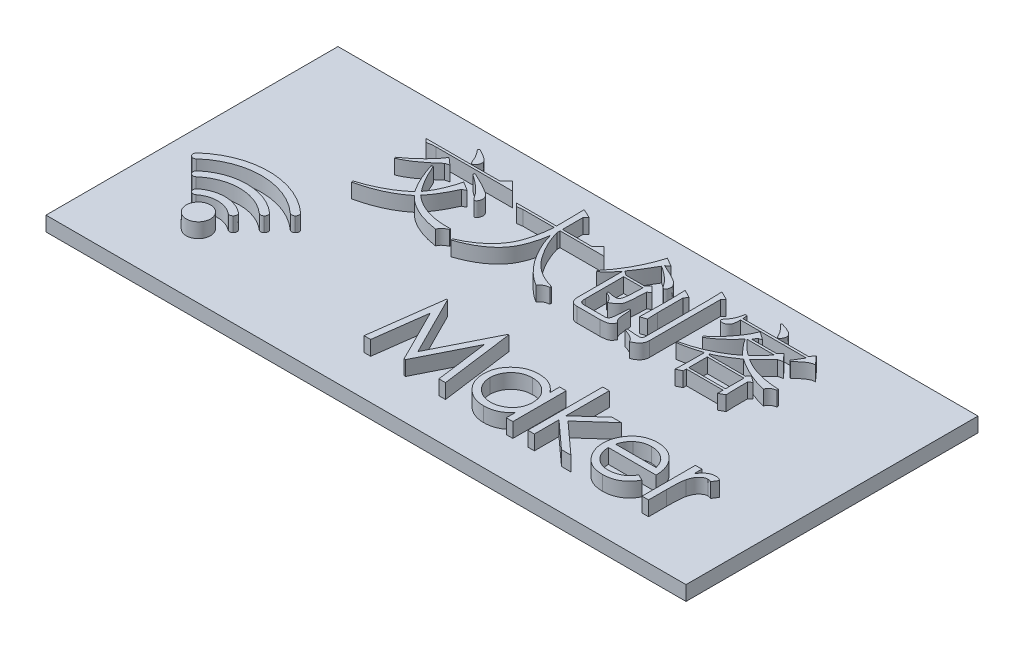
from build123d import *

# Parameters (mm, degrees)
SKETCH_1_W          = 50
SKETCH_1_H          = 20
EXTRUDE_1_DEPTH     = 1
SKETCH_2_R          = 0.830908048
SKETCH_2_W          = 2.515024038
SKETCH_2_H          = 1.271033654
EXTRUDE_2_DEPTH     = 1
SKETCH_3_W          = 6.162950286
SKETCH_3_H          = 20
CUT_EXTRUDE_1_DEPTH = 1


with BuildPart() as part:
    # 草图1 → 凸台-拉伸1 (new body)
    with BuildSketch(Plane(origin=(0, 0, 0), x_dir=(1, 0, 0), z_dir=(0, 1, 0))):
        with Locations((-40.526499991, 21.466845582)):
            Rectangle(SKETCH_1_W, SKETCH_1_H)
    extrude(amount=EXTRUDE_1_DEPTH)

    # 草图2 → 凸台-拉伸2 (add)
    # profile 1 of 21: a face of its own
    with BuildSketch(Plane(origin=(0, 1, 0), x_dir=(1, 0, 0), z_dir=(0, 1, 0))):
        with Locations(Location((-59.496617873, 15.874712828, 0), (0, 0, 90))):
            Circle(SKETCH_2_R)
    # profile 2 of 21: a face of its own
    with BuildSketch(Plane(origin=(0, 1, 0), x_dir=(1, 0, 0), z_dir=(0, 1, 0))):
        with BuildLine():
            Line((-58.075757058, 16.832043114), (-58.061515401, 16.846284771))
            ThreePointArc((-58.061515401, 16.846284771), (-57.991636554, 17.030107048), (-58.082619061, 17.204451151))
            ThreePointArc((-58.082619061, 17.204451151), (-59.496617873, 17.694864811), (-60.910616685, 17.204451151))
            ThreePointArc((-60.910616685, 17.204451151), (-61.001599192, 17.030107048), (-60.931720345, 16.846284771))
            Line((-60.931720345, 16.846284771), (-60.917478688, 16.832043114))
            ThreePointArc((-60.917478688, 16.832043114), (-60.762029718, 16.762172558), (-60.599391462, 16.813114436))
            ThreePointArc((-60.599391462, 16.813114436), (-59.496617873, 17.194864811), (-58.393844284, 16.813114436))
            ThreePointArc((-58.393844284, 16.813114436), (-58.231206028, 16.762172558), (-58.075757058, 16.832043114))
        make_face()
    # profile 3 of 21: a face of its own
    with BuildSketch(Plane(origin=(0, 1, 0), x_dir=(1, 0, 0), z_dir=(0, 1, 0))):
        with BuildLine():
            Line((-63.044841794, 18.95940622), (-63.059000031, 18.973564458))
            ThreePointArc((-63.059000031, 18.973564458), (-63.129226428, 19.148981816), (-63.050732473, 19.320858795))
            ThreePointArc((-63.050732473, 19.320858795), (-59.496617873, 20.694864811), (-55.942503273, 19.320858795))
            ThreePointArc((-55.942503273, 19.320858795), (-55.864009318, 19.148981816), (-55.934235715, 18.973564458))
            Line((-55.934235715, 18.973564458), (-55.948393952, 18.95940622))
            ThreePointArc((-55.948393952, 18.95940622), (-56.112365096, 18.889180366), (-56.279503966, 18.951492524))
            ThreePointArc((-56.279503966, 18.951492524), (-59.496617873, 20.194864811), (-62.713731781, 18.951492524))
            ThreePointArc((-62.713731781, 18.951492524), (-62.88087065, 18.889180366), (-63.044841794, 18.95940622))
        make_face()
    # profile 4 of 21: a face of its own
    with BuildSketch(Plane(origin=(0, 1, 0), x_dir=(1, 0, 0), z_dir=(0, 1, 0))):
        with BuildLine():
            Line((-61.982451581, 17.897016007), (-61.996626448, 17.911190874))
            ThreePointArc((-61.996626448, 17.911190874), (-62.066783018, 18.089028309), (-61.984743285, 18.261705986))
            ThreePointArc((-61.984743285, 18.261705986), (-59.496617873, 19.194864811), (-57.008492461, 18.261705986))
            ThreePointArc((-57.008492461, 18.261705986), (-56.926452728, 18.089028309), (-56.996609298, 17.911190874))
            Line((-56.996609298, 17.911190874), (-57.010784165, 17.897016007))
            ThreePointArc((-57.010784165, 17.897016007), (-57.172311776, 17.826861008), (-57.33824258, 17.885851355))
            ThreePointArc((-57.33824258, 17.885851355), (-59.496617873, 18.694864811), (-61.654993166, 17.885851355))
            ThreePointArc((-61.654993166, 17.885851355), (-61.82092397, 17.826861008), (-61.982451581, 17.897016007))
        make_face()
    # profile 5 of 21: a face of its own
    with BuildSketch(Plane(origin=(0, 1, 0), x_dir=(1, 0, 0), z_dir=(0, 1, 0))):
        with BuildLine():
            Line((-53.64328982, 29.139799369), (-53.562160012, 29.220929177))
            add(Edge.make_bspline(
                [(-53.562160012, 29.220929177), (-53.494118289, 29.186373454), (-53.365958322, 29.121286033), (-53.189502909, 29.022143664), (-53.038999885, 28.929570229), (-52.916049838, 28.841363775), (-52.816647409, 28.761766046), (-52.746719739, 28.685157005), (-52.698826056, 28.615421667), (-52.676851693, 28.528594496), (-52.685862911, 28.429949254), (-52.711655143, 28.319877751), (-52.767988715, 28.221834511), (-52.829074824, 28.150882058), (-52.885337253, 28.107265815), (-52.927986215, 28.087310354), (-52.971026336, 28.087671979), (-53.011974785, 28.104020435), (-53.048157352, 28.13905785), (-53.082719668, 28.187789108), (-53.11602862, 28.252204137), (-53.144468499, 28.331518973), (-53.177073038, 28.420431643), (-53.22091012, 28.512822678), (-53.271141482, 28.609491204), (-53.32905665, 28.709800963), (-53.396683765, 28.812322698), (-53.47091532, 28.919299716), (-53.553992994, 29.028786679), (-53.613059616, 29.10221756), (-53.64328982, 29.139799369)],
                knots=[0, 0, 0, 0, 2.144292885, 4.038882262, 5.68679817, 7.105754492, 8.291413814, 9.254501771, 10.017297393, 10.638584386, 11.727937091, 12.765642189, 13.794487315, 14.871283042, 15.374175676, 15.790604302, 16.1658947, 16.549191886, 17.001101369, 17.558458152, 18.225720893, 19.030683805, 19.92456259, 20.885866583, 21.901406839, 22.986022062, 24.138857114, 25.351747841, 26.644628711, 28, 28, 28, 28], degree=3))
        make_face()
    # profile 6 of 21: a face of its own
    with BuildSketch(Plane(origin=(0, 1, 0), x_dir=(1, 0, 0), z_dir=(0, 1, 0))):
        with BuildLine():
            Line((-56.07718405, 28.031025331), (-50.993049435, 28.031025331))
            Line((-50.993049435, 28.031025331), (-50.560357127, 28.463717638))
            Line((-50.560357127, 28.463717638), (-49.965405204, 27.868765715))
            Line((-49.965405204, 27.868765715), (-55.211799435, 27.868765715))
            add(Edge.make_bspline(
                [(-55.211799435, 27.868765715), (-55.265252031, 27.867800708), (-55.371368123, 27.865884939), (-55.529039056, 27.850607394), (-55.683266298, 27.824752896), (-55.783850913, 27.799950933), (-55.833794627, 27.787635907)],
                knots=[0, 0, 0, 0, 1.019603107, 2.024154194, 3.018924741, 4, 4, 4, 4], degree=3))
            Line((-55.833794627, 27.787635907), (-56.07718405, 28.031025331))
        make_face()
    # profile 7 of 21: a face of its own
    with BuildSketch(Plane(origin=(0, 1, 0), x_dir=(1, 0, 0), z_dir=(0, 1, 0))):
        with BuildLine():
            Line((-54.157111935, 27.7065061), (-53.670333089, 27.273813792))
            Line((-53.670333089, 27.273813792), (-53.940765781, 27.192683984))
            add(Edge.make_bspline(
                [(-53.940765781, 27.192683984), (-54.037831155, 27.106063305), (-54.225957495, 26.93818025), (-54.506390422, 26.702031568), (-54.776564018, 26.490864815), (-55.035427333, 26.302537098), (-55.283354635, 26.13776561), (-55.520733887, 25.99743784), (-55.746433886, 25.878945288), (-55.896760715, 25.816463875), (-55.969010973, 25.786433984)],
                knots=[0, 0, 0, 0, 1.258722699, 2.439581546, 3.546529027, 4.575866391, 5.536328555, 6.425529481, 7.243276122, 8, 8, 8, 8], degree=3))
            Line((-55.969010973, 25.786433984), (-55.996054243, 25.867563792))
            add(Edge.make_bspline(
                [(-55.996054243, 25.867563792), (-55.886145753, 25.945017911), (-55.668988806, 26.098051585), (-55.359981487, 26.342220418), (-55.073067343, 26.598787795), (-54.850344748, 26.819351821), (-54.686441869, 26.995954428), (-54.575340541, 27.119639382), (-54.476097025, 27.235815014), (-54.388369865, 27.343953311), (-54.313338999, 27.444981801), (-54.249586015, 27.538181463), (-54.198069557, 27.624193659), (-54.170153187, 27.680297126), (-54.157111935, 27.7065061)],
                knots=[0, 0, 0, 0, 1.846203381, 3.647724496, 5.40447383, 7.129181172, 7.94990274, 8.712915981, 9.41210171, 10.047929088, 10.624697264, 11.1397017, 11.598107976, 12, 12, 12, 12], degree=3))
        make_face()
    # profile 8 of 21: a face of its own
    with BuildSketch(Plane(origin=(0, 1, 0), x_dir=(1, 0, 0), z_dir=(0, 1, 0))):
        with BuildLine():
            Line((-52.345212896, 27.517203215), (-52.291126358, 27.625376292))
            add(Edge.make_bspline(
                [(-52.291126358, 27.625376292), (-52.214600008, 27.5901396), (-52.06618045, 27.521799554), (-51.851515853, 27.41990779), (-51.65222566, 27.320301348), (-51.46718288, 27.225898985), (-51.297430466, 27.134322051), (-51.142163276, 27.047178826), (-51.00080285, 26.964911403), (-50.875398017, 26.884562654), (-50.764920037, 26.808067697), (-50.674471959, 26.727825167), (-50.604315615, 26.644654839), (-50.551276359, 26.560698724), (-50.520725332, 26.472952754), (-50.507721467, 26.384013672), (-50.516232038, 26.292871402), (-50.544874574, 26.206065383), (-50.58127712, 26.129651555), (-50.618996314, 26.067840303), (-50.661819046, 26.028237678), (-50.708589126, 26.008464604), (-50.758113465, 26.017009792), (-50.806313921, 26.046758507), (-50.854082775, 26.098318859), (-50.919023855, 26.194584334), (-51.005751756, 26.328325993), (-51.128212399, 26.485468862), (-51.263304842, 26.639979009), (-51.387966797, 26.764810088), (-51.497195801, 26.865925745), (-51.589192297, 26.946961129), (-51.691475241, 27.032024692), (-51.803664882, 27.120774559), (-51.924961371, 27.214262433), (-52.056594855, 27.311211063), (-52.197339038, 27.413262186), (-52.295043195, 27.481938764), (-52.345212896, 27.517203215)],
                knots=[0, 0, 0, 0, 1.843623007, 3.575627363, 5.199504202, 6.718910345, 8.121247437, 9.419870552, 10.615247861, 11.699521204, 12.678773126, 13.55308725, 14.336059413, 15.054022205, 15.712577896, 16.354219458, 17.007076785, 17.69570545, 18.342772991, 18.859489891, 19.268431234, 19.603633443, 19.928073357, 20.324083872, 20.825225681, 21.453713235, 22.864058866, 24.312236502, 25.808472891, 27.353156156, 28.169993959, 29.065540297, 30.035591505, 31.08076093, 32.195737051, 33.386640627, 34.65807694, 36, 36, 36, 36], degree=3))
        make_face()
    # profile 9 of 21: a face of its own
    with BuildSketch(Plane(origin=(0, 1, 0), x_dir=(1, 0, 0), z_dir=(0, 1, 0))):
        with BuildLine():
            Line((-51.560958089, 26.354342638), (-51.831390781, 26.219126292))
            add(Edge.make_bspline(
                [(-51.831390781, 26.219126292), (-51.873957334, 26.125076369), (-51.956728078, 25.942196116), (-52.085948257, 25.678939553), (-52.217028342, 25.434978442), (-52.348237141, 25.208901695), (-52.479853509, 25.001199252), (-52.613675245, 24.81297252), (-52.745618347, 24.640964852), (-52.840260848, 24.538137073), (-52.886078281, 24.488357061)],
                knots=[0, 0, 0, 0, 1.216875134, 2.366216015, 3.45615382, 4.480820304, 5.447035653, 6.353364129, 7.202846209, 8, 8, 8, 8], degree=3))
            add(Edge.make_bspline(
                [(-52.886078281, 24.488357061), (-52.83705724, 24.4454947), (-52.739314454, 24.36003167), (-52.586133614, 24.240427323), (-52.426080277, 24.131764958), (-52.262152212, 24.029616272), (-52.091132434, 23.93916905), (-51.915729796, 23.855383793), (-51.734119163, 23.781191644), (-51.546884397, 23.716841896), (-51.355164151, 23.658643195), (-51.15721005, 23.6123948), (-50.954145763, 23.573019181), (-50.745226904, 23.543067809), (-50.530997106, 23.522126925), (-50.311117139, 23.510286338), (-50.085883461, 23.506934593), (-49.934011904, 23.512158423), (-49.857232127, 23.514799369)],
                knots=[0, 0, 0, 0, 0.956443101, 1.907046679, 2.852474519, 3.797075173, 4.742744668, 5.692639521, 6.651644258, 7.62257587, 8.600123956, 9.593391141, 10.607174816, 11.637829183, 12.692394954, 13.768052322, 14.871622525, 16, 16, 16, 16], degree=3))
            Line((-49.857232127, 23.514799369), (-49.857232127, 23.433669561))
            add(Edge.make_bspline(
                [(-49.857232127, 23.433669561), (-49.891544303, 23.417814531), (-49.95722331, 23.38746546), (-50.047671582, 23.335806594), (-50.127522492, 23.283690804), (-50.194369067, 23.226790783), (-50.2500584, 23.167982014), (-50.293705914, 23.105910508), (-50.327328565, 23.041895535), (-50.338526663, 22.996276217), (-50.344010973, 22.973933984)],
                knots=[0, 0, 0, 0, 1.304768029, 2.497535254, 3.594437195, 4.592464445, 5.522502126, 6.383042226, 7.208088858, 8, 8, 8, 8], degree=3))
            add(Edge.make_bspline(
                [(-50.344010973, 22.973933984), (-50.418539799, 22.985847357), (-50.565294561, 23.009305987), (-50.781434822, 23.051645369), (-50.990643843, 23.099388841), (-51.192913209, 23.153800104), (-51.388309538, 23.212312429), (-51.576321675, 23.277813393), (-51.757301004, 23.348901648), (-51.932006499, 23.42478953), (-52.099442027, 23.507021517), (-52.259971521, 23.595101587), (-52.413093871, 23.689480373), (-52.559888791, 23.788507314), (-52.699370823, 23.894153677), (-52.832251108, 24.004900324), (-52.958380589, 24.121208783), (-53.036442329, 24.203779586), (-53.075381166, 24.244967638)],
                knots=[0, 0, 0, 0, 1.179268939, 2.322099272, 3.440813095, 4.531627804, 5.594464033, 6.627274672, 7.641579044, 8.632127192, 9.602705386, 10.555325523, 11.492115207, 12.412373561, 13.321159577, 14.224900413, 15.114543026, 16, 16, 16, 16], degree=3))
            add(Edge.make_bspline(
                [(-53.075381166, 24.244967638), (-53.172448833, 24.16737832), (-53.368433982, 24.010721067), (-53.685848702, 23.800368334), (-54.023158841, 23.605279773), (-54.382232998, 23.428571069), (-54.762252751, 23.268082545), (-55.162743493, 23.124152387), (-55.584776343, 22.997327426), (-55.875151009, 22.928083899), (-56.023097512, 22.892804177)],
                knots=[0, 0, 0, 0, 0.910736282, 1.838828433, 2.78857478, 3.766181164, 4.770964788, 5.811640811, 6.885026388, 8, 8, 8, 8], degree=3))
            Line((-56.023097512, 22.892804177), (-56.050140781, 23.000977254))
            add(Edge.make_bspline(
                [(-56.050140781, 23.000977254), (-55.913114379, 23.04467446), (-55.642853524, 23.130859636), (-55.251441034, 23.282015591), (-54.877713057, 23.446016241), (-54.523137298, 23.624979907), (-54.187388157, 23.819126551), (-53.869796231, 24.026302445), (-53.569436921, 24.24689221), (-53.383828545, 24.408276255), (-53.29172732, 24.488357061)],
                knots=[0, 0, 0, 0, 1.092636451, 2.155036239, 3.1863881, 4.19271652, 5.171317095, 6.131772875, 7.072962052, 8, 8, 8, 8], degree=3))
            add(Edge.make_bspline(
                [(-53.29172732, 24.488357061), (-53.338838294, 24.558017686), (-53.434939269, 24.700117358), (-53.56872363, 24.926466194), (-53.697761639, 25.167872652), (-53.821561859, 25.424373732), (-53.941149866, 25.695506022), (-54.055043771, 25.982273715), (-54.164163538, 26.284288097), (-54.231181279, 26.492021486), (-54.265285012, 26.597732061)],
                knots=[0, 0, 0, 0, 0.865336982, 1.765188034, 2.704463473, 3.681869899, 4.695735872, 5.753660105, 6.856891113, 8, 8, 8, 8], degree=3))
            Line((-54.265285012, 26.597732061), (-54.157111935, 26.624775331))
            add(Edge.make_bspline(
                [(-54.157111935, 26.624775331), (-54.116652776, 26.530020655), (-54.037071436, 26.343642481), (-53.909346771, 26.07344845), (-53.779553611, 25.816029124), (-53.646576742, 25.572119803), (-53.509053162, 25.342569149), (-53.368715265, 25.126127144), (-53.226431401, 24.9218862), (-53.125116848, 24.794352997), (-53.075381166, 24.731746484)],
                knots=[0, 0, 0, 0, 1.130319644, 2.223287765, 3.278275292, 4.29299708, 5.270486894, 6.213362401, 7.122933106, 8, 8, 8, 8], degree=3))
            add(Edge.make_bspline(
                [(-53.075381166, 24.731746484), (-53.028420123, 24.794900726), (-52.932744521, 24.923567374), (-52.802915963, 25.132697986), (-52.679926967, 25.357764154), (-52.564902336, 25.600129347), (-52.456630187, 25.858708686), (-52.356806464, 26.13459437), (-52.264514621, 26.427409001), (-52.210551671, 26.629561242), (-52.182953281, 26.732948407)],
                knots=[0, 0, 0, 0, 0.855902828, 1.743764888, 2.675175682, 3.645111986, 4.661036153, 5.723906938, 6.835932711, 8, 8, 8, 8], degree=3))
            Line((-52.182953281, 26.732948407), (-51.560958089, 26.354342638))
        make_face()
    # profile 10 of 21: a face of its own
    with BuildSketch(Plane(origin=(0, 1, 0), x_dir=(1, 0, 0), z_dir=(0, 1, 0))):
        with BuildLine():
            add(Edge.make_bspline(
                [(-46.395693666, 27.300857061), (-46.395487078, 27.415374275), (-46.395091967, 27.634394753), (-46.397774278, 27.948226218), (-46.399374004, 28.232686349), (-46.402195562, 28.487769728), (-46.406674919, 28.713115713), (-46.409773493, 28.908807363), (-46.416137757, 29.074720405), (-46.420687627, 29.175525523), (-46.422736935, 29.220929177)],
                knots=[0, 0, 0, 0, 1.43114318, 2.737140148, 3.922139395, 4.986182443, 5.925127331, 6.738922164, 7.431997678, 8, 8, 8, 8], degree=3))
            Line((-46.422736935, 29.220929177), (-45.773698473, 28.923453215))
            Line((-45.773698473, 28.923453215), (-45.990044627, 28.707107061))
            Line((-45.990044627, 28.707107061), (-45.990044627, 27.300857061))
            Line((-45.990044627, 27.300857061), (-43.988842704, 27.300857061))
            Line((-43.988842704, 27.300857061), (-43.556150396, 27.733549369))
            Line((-43.556150396, 27.733549369), (-42.961198473, 27.138597446))
            Line((-42.961198473, 27.138597446), (-45.990044627, 27.138597446))
            Line((-45.990044627, 27.138597446), (-45.990044627, 26.922251292))
            add(Edge.make_bspline(
                [(-45.990044627, 26.922251292), (-45.966334907, 26.83846818), (-45.918492832, 26.669408489), (-45.82757219, 26.419136211), (-45.72603911, 26.167414483), (-45.609123126, 25.915680033), (-45.479022761, 25.663270355), (-45.334264402, 25.41053844), (-45.175766518, 25.157376177), (-45.005717588, 24.904925565), (-44.819843701, 24.661651277), (-44.612492895, 24.438061355), (-44.385982969, 24.236635837), (-44.142758007, 24.053884172), (-43.880418171, 23.893760309), (-43.600156175, 23.75421771), (-43.302328259, 23.633789786), (-43.093999367, 23.572802617), (-42.988241743, 23.541842638)],
                knots=[0, 0, 0, 0, 0.881499975, 1.778713054, 2.694738048, 3.629612149, 4.588313477, 5.56961773, 6.578112427, 7.612459253, 8.651217289, 9.675162042, 10.695225597, 11.716963118, 12.752017001, 13.802875653, 14.884635491, 16, 16, 16, 16], degree=3))
            Line((-42.988241743, 23.541842638), (-42.988241743, 23.433669561))
            add(Edge.make_bspline(
                [(-42.988241743, 23.433669561), (-43.021077149, 23.430803642), (-43.085008635, 23.425223613), (-43.176700758, 23.403616318), (-43.261712892, 23.37342151), (-43.340632595, 23.334538986), (-43.412120369, 23.284859274), (-43.476721719, 23.226268301), (-43.534513366, 23.158476424), (-43.566753747, 23.107897908), (-43.583193666, 23.082107061)],
                knots=[0, 0, 0, 0, 1.094905193, 2.131812063, 3.122140153, 4.090376362, 5.048180135, 6.00714153, 6.98380754, 8, 8, 8, 8], degree=3))
            add(Edge.make_bspline(
                [(-43.583193666, 23.082107061), (-43.656915138, 23.128279236), (-43.804572386, 23.220757806), (-44.015897851, 23.376333166), (-44.220263947, 23.54338091), (-44.41709105, 23.723386209), (-44.606606665, 23.915702056), (-44.787729745, 24.121352001), (-44.961426141, 24.339387091), (-45.126604373, 24.568527557), (-45.281677069, 24.805551181), (-45.425864262, 25.046382487), (-45.559997554, 25.288533837), (-45.679794549, 25.534751885), (-45.789363838, 25.782766321), (-45.886259485, 26.033976207), (-45.973556877, 26.28677404), (-46.020664613, 26.458233565), (-46.044131166, 26.543645523)],
                knots=[0, 0, 0, 0, 0.96029755, 1.923386638, 2.89538274, 3.874012849, 4.867311716, 5.875558051, 6.898739407, 7.944508297, 8.993677142, 10.025576151, 11.043663327, 12.049473262, 13.048230981, 14.036893623, 15.022085475, 16, 16, 16, 16], degree=3))
            add(Edge.make_bspline(
                [(-46.044131166, 26.543645523), (-46.054335752, 26.475789473), (-46.074395971, 26.342397767), (-46.11233588, 26.146215998), (-46.152868669, 25.956742302), (-46.197783107, 25.773540351), (-46.248554059, 25.59756909), (-46.300500867, 25.427292483), (-46.359322587, 25.26458969), (-46.421380001, 25.108237145), (-46.486914368, 24.957755173), (-46.558577486, 24.814982475), (-46.632120364, 24.677904549), (-46.711964122, 24.548806484), (-46.794449326, 24.425045109), (-46.883347418, 24.309388484), (-46.973913767, 24.198272519), (-47.103178042, 24.061010665), (-47.275377942, 23.898823445), (-47.497319831, 23.716251107), (-47.736046765, 23.544680802), (-47.992423585, 23.385538634), (-48.264927943, 23.237278856), (-48.554712663, 23.101004528), (-48.860953063, 22.975572197), (-49.073255777, 22.902763237), (-49.181150396, 22.865760907)],
                knots=[0, 0, 0, 0, 0.956776793, 1.880835804, 2.78577915, 3.658632239, 4.510459326, 5.339500193, 6.14060475, 6.922151859, 7.685118115, 8.428427445, 9.149263997, 9.853521783, 10.544355619, 11.222235269, 11.886892006, 12.542420032, 13.849875243, 15.182779295, 16.54718437, 17.946265727, 19.387938832, 20.87076174, 22.40968602, 24, 24, 24, 24], degree=3))
            Line((-49.181150396, 22.865760907), (-49.208193666, 22.973933984))
            add(Edge.make_bspline(
                [(-49.208193666, 22.973933984), (-49.130448328, 23.008369541), (-48.976927162, 23.076368304), (-48.754067333, 23.18806844), (-48.540490489, 23.306261177), (-48.335992349, 23.431144786), (-48.141633613, 23.563873516), (-47.955729279, 23.702010697), (-47.779281256, 23.84747686), (-47.612168185, 23.999256148), (-47.455708246, 24.157455192), (-47.311075195, 24.321630151), (-47.179620547, 24.492518217), (-47.060092289, 24.669067313), (-46.952715366, 24.851735512), (-46.857483054, 25.0399764), (-46.774680377, 25.234344046), (-46.682644323, 25.502124486), (-46.586332148, 25.845585164), (-46.496371836, 26.267500598), (-46.430140551, 26.699284961), (-46.407227656, 26.991500667), (-46.395693666, 27.138597446)],
                knots=[0, 0, 0, 0, 0.952168126, 1.880215142, 2.790681094, 3.685253718, 4.562618306, 5.425595402, 6.278239608, 7.122579442, 7.952784657, 8.76882458, 9.571294346, 10.365674422, 11.155075891, 11.942668837, 12.726739213, 13.519031026, 15.11222003, 16.718274176, 18.348030959, 20, 20, 20, 20], degree=3))
            Line((-46.395693666, 27.138597446), (-48.532111935, 27.138597446))
            Line((-48.532111935, 27.138597446), (-48.910717704, 27.084510907))
            Line((-48.910717704, 27.084510907), (-49.127063858, 27.300857061))
            Line((-49.127063858, 27.300857061), (-46.395693666, 27.300857061))
        make_face()
    # profile 11 of 21: a face of its own
    with BuildSketch(Plane(origin=(0, 1, 0), x_dir=(1, 0, 0), z_dir=(0, 1, 0))):
        with BuildLine():
            Line((-40.094611935, 28.842323407), (-40.338001358, 28.653020523))
            add(Edge.make_bspline(
                [(-40.338001358, 28.653020523), (-40.252071643, 28.61591561), (-40.087959623, 28.545051157), (-39.855897073, 28.439500074), (-39.649976125, 28.339030581), (-39.469499241, 28.245619859), (-39.314890689, 28.157287647), (-39.184843292, 28.076575478), (-39.082162421, 27.999204199), (-39.001890526, 27.928083546), (-38.941931521, 27.858143546), (-38.894359702, 27.790790321), (-38.859505597, 27.722224555), (-38.836064136, 27.654178008), (-38.824439103, 27.585421628), (-38.825877082, 27.517018415), (-38.837825939, 27.44810111), (-38.862398364, 27.383190324), (-38.89273763, 27.326933359), (-38.926265279, 27.283628398), (-38.967009787, 27.259571241), (-39.01218986, 27.257941314), (-39.057651198, 27.276999833), (-39.105041553, 27.312435436), (-39.153895936, 27.367588815), (-39.222792041, 27.465171127), (-39.315378546, 27.597879408), (-39.44478742, 27.750231567), (-39.587193091, 27.895668593), (-39.742747129, 28.032963986), (-39.906114487, 28.163740361), (-40.073450973, 28.289036396), (-40.24375169, 28.407972847), (-40.360723148, 28.481226178), (-40.419131166, 28.517804177)],
                knots=[0, 0, 0, 0, 2.120892494, 4.050565631, 5.776136364, 7.312397299, 8.65425382, 9.810657897, 10.777509236, 11.564774153, 12.235190384, 12.860553744, 13.428959798, 13.972031024, 14.485692724, 15.00018942, 15.515130894, 16.063237464, 16.564378575, 16.96153933, 17.289999263, 17.600545788, 17.947644316, 18.386497502, 18.932564064, 19.608929846, 21.0934665, 22.596813692, 24.132198877, 25.702233088, 27.294906014, 28.87303038, 30.438592617, 32, 32, 32, 32], degree=3))
            add(Edge.make_bspline(
                [(-40.419131166, 28.517804177), (-40.471316396, 28.426856494), (-40.571548552, 28.25217331), (-40.719444882, 28.003019597), (-40.854733676, 27.775002484), (-40.982364125, 27.571328427), (-41.097861631, 27.389113166), (-41.205260113, 27.231406472), (-41.300929078, 27.095180097), (-41.363710956, 27.01386843), (-41.392688858, 26.976337831)],
                knots=[0, 0, 0, 0, 1.379268318, 2.649160212, 3.811315595, 4.866661507, 5.81080611, 6.648848274, 7.376355994, 8, 8, 8, 8], degree=3))
            Line((-41.392688858, 26.976337831), (-41.095212896, 26.759991677))
            Line((-41.095212896, 26.759991677), (-39.797135973, 26.759991677))
            Line((-39.797135973, 26.759991677), (-39.55374655, 27.0033811))
            Line((-39.55374655, 27.0033811), (-39.175140781, 26.624775331))
            Line((-39.175140781, 26.624775331), (-39.391486935, 26.462515715))
            add(Edge.make_bspline(
                [(-39.391486935, 26.462515715), (-39.393902022, 26.366021361), (-39.398482616, 26.183004554), (-39.408897003, 25.923493961), (-39.424211412, 25.694471137), (-39.440706153, 25.4950183), (-39.460045354, 25.325547726), (-39.482466988, 25.185646583), (-39.50736053, 25.07583258), (-39.536692044, 24.990547651), (-39.576549336, 24.922990793), (-39.622956483, 24.860617332), (-39.67967101, 24.799190195), (-39.747004266, 24.739075519), (-39.825880044, 24.681113004), (-39.915147177, 24.624399159), (-40.014416728, 24.568169566), (-40.085075198, 24.53340039), (-40.121655204, 24.515400331)],
                knots=[0, 0, 0, 0, 2.059499433, 3.906166493, 5.540959121, 6.956614573, 8.175972802, 9.179612333, 9.977865133, 10.57734619, 11.094234477, 11.644181219, 12.23406245, 12.874747988, 13.567164547, 14.320041651, 15.130282795, 16, 16, 16, 16], degree=3))
            add(Edge.make_bspline(
                [(-40.121655204, 24.515400331), (-40.135995953, 24.548123597), (-40.164228951, 24.612546729), (-40.217696106, 24.70194667), (-40.279339723, 24.7830688), (-40.349666749, 24.855767433), (-40.429663175, 24.918839744), (-40.517070528, 24.974277085), (-40.61323323, 25.020920018), (-40.681603952, 25.044297398), (-40.716607127, 25.056265715)],
                knots=[0, 0, 0, 0, 1.028437197, 2.024710615, 2.992298439, 3.958116007, 4.929948808, 5.919888337, 6.935062998, 8, 8, 8, 8], degree=3))
            Line((-40.716607127, 25.056265715), (-40.716607127, 25.164438792))
            add(Edge.make_bspline(
                [(-40.716607127, 25.164438792), (-40.675578144, 25.155910096), (-40.59768062, 25.139717535), (-40.486488127, 25.119516432), (-40.386577096, 25.104522532), (-40.298140766, 25.092999378), (-40.220900393, 25.087143271), (-40.155376388, 25.084434642), (-40.100939662, 25.086906017), (-40.04360298, 25.096836789), (-39.981561362, 25.124887547), (-39.92395574, 25.185590938), (-39.878831172, 25.267570725), (-39.852243867, 25.354390595), (-39.836324377, 25.444216957), (-39.824978071, 25.538237131), (-39.812623902, 25.655702049), (-39.803604348, 25.797755718), (-39.793184516, 25.963646175), (-39.784538734, 26.153651539), (-39.776447259, 26.367664352), (-39.772287561, 26.518266892), (-39.770092704, 26.597732061)],
                knots=[0, 0, 0, 0, 1.113104714, 2.113337826, 3.001320417, 3.796605132, 4.481534559, 5.058247165, 5.537874069, 5.925754694, 6.600270736, 7.302604627, 8.10888911, 9.068060928, 9.699456813, 10.531046582, 11.582903775, 12.836475568, 14.311282888, 15.998150052, 17.888430789, 20, 20, 20, 20], degree=3))
            Line((-39.770092704, 26.597732061), (-41.095212896, 26.597732061))
            Line((-41.095212896, 26.597732061), (-41.095212896, 24.001578215))
            add(Edge.make_bspline(
                [(-41.095212896, 24.001578215), (-41.098619396, 23.967891938), (-41.104996184, 23.904832991), (-41.09816256, 23.815761601), (-41.078961913, 23.739203123), (-41.04443194, 23.676008331), (-40.995109246, 23.626647403), (-40.931908418, 23.592275391), (-40.855331208, 23.572386988), (-40.800201191, 23.570106503), (-40.770693666, 23.568885907)],
                knots=[0, 0, 0, 0, 1.270994923, 2.379235944, 3.341563178, 4.218277822, 5.052717101, 5.929431745, 6.891758979, 8, 8, 8, 8], degree=3))
            Line((-40.770693666, 23.568885907), (-39.364443666, 23.568885907))
            add(Edge.make_bspline(
                [(-39.364443666, 23.568885907), (-39.335133529, 23.570252239), (-39.279935211, 23.572825382), (-39.204490863, 23.601633949), (-39.145036357, 23.65035792), (-39.108568694, 23.709058054), (-39.087704271, 23.775976836), (-39.073005207, 23.853674734), (-39.057038822, 23.957573766), (-39.041465105, 24.087859342), (-39.026500006, 24.245154106), (-39.013082248, 24.428873417), (-38.998969951, 24.639209084), (-38.990381482, 24.788161868), (-38.985837896, 24.866962831)],
                knots=[0, 0, 0, 0, 0.713614022, 1.343913671, 1.935196158, 2.56221325, 3.00082633, 3.642482699, 4.492930227, 5.569691268, 6.848353037, 8.353933498, 10.071109905, 12, 12, 12, 12], degree=3))
            Line((-38.985837896, 24.866962831), (-38.87766482, 24.866962831))
            add(Edge.make_bspline(
                [(-38.87766482, 24.866962831), (-38.873179963, 24.797172258), (-38.864484657, 24.661861273), (-38.848777714, 24.465816303), (-38.829839082, 24.283310908), (-38.815821279, 24.139709071), (-38.798890713, 24.033025216), (-38.78116194, 23.960400755), (-38.756860552, 23.893642772), (-38.727252124, 23.832650421), (-38.691378465, 23.777954317), (-38.651796198, 23.728203977), (-38.604836522, 23.685850879), (-38.570441625, 23.662006334), (-38.553145589, 23.650015715)],
                knots=[0, 0, 0, 0, 1.928403044, 3.738816054, 5.422514933, 6.988160693, 7.716147585, 8.399392348, 9.04592562, 9.671742581, 10.264165649, 10.846488216, 11.419937755, 12, 12, 12, 12], degree=3))
            add(Edge.make_bspline(
                [(-38.553145589, 23.650015715), (-38.566651251, 23.624006825), (-38.592584644, 23.574064897), (-38.638527435, 23.5064034), (-38.68626234, 23.446921195), (-38.737495451, 23.396172207), (-38.792153784, 23.355228551), (-38.848462439, 23.320717171), (-38.909513317, 23.298043192), (-38.991072751, 23.279378055), (-39.088318249, 23.268479127), (-39.193575754, 23.253966166), (-39.284228527, 23.247058338), (-39.339397274, 23.245207122), (-39.364443666, 23.244366677)],
                knots=[0, 0, 0, 0, 1.083903224, 2.08129669, 3.021224119, 3.903837086, 4.741713362, 5.544973098, 6.339054607, 7.139362048, 8.637110079, 9.956855873, 11.072420668, 12, 12, 12, 12], degree=3))
            Line((-39.364443666, 23.244366677), (-40.932953281, 23.244366677))
            add(Edge.make_bspline(
                [(-40.932953281, 23.244366677), (-40.973164739, 23.245980493), (-41.049198075, 23.249031958), (-41.156283526, 23.274879574), (-41.247385367, 23.320220389), (-41.321927448, 23.384367468), (-41.379737467, 23.466479839), (-41.418885338, 23.566741004), (-41.443015369, 23.683936022), (-41.4454706, 23.767739314), (-41.446775396, 23.812275331)],
                knots=[0, 0, 0, 0, 1.099363477, 2.078717783, 2.989818221, 3.857854353, 4.742509455, 5.70951414, 6.782755265, 8, 8, 8, 8], degree=3))
            Line((-41.446775396, 23.812275331), (-41.446775396, 26.868164754))
            add(Edge.make_bspline(
                [(-41.446775396, 26.868164754), (-41.51469528, 26.78463065), (-41.64866829, 26.619858352), (-41.862285337, 26.388111375), (-42.08137114, 26.172043015), (-42.235892096, 26.04060941), (-42.312160012, 25.975736869)],
                knots=[0, 0, 0, 0, 1.037186115, 2.045865492, 3.035485082, 4, 4, 4, 4], degree=3))
            Line((-42.312160012, 25.975736869), (-42.36624655, 26.056866677))
            add(Edge.make_bspline(
                [(-42.36624655, 26.056866677), (-42.30672665, 26.130652351), (-42.189138029, 26.2764247), (-42.022434269, 26.497995215), (-41.864247794, 26.717472959), (-41.717631498, 26.936711634), (-41.579961117, 27.153705209), (-41.45350543, 27.370111812), (-41.336181216, 27.584515708), (-41.230717268, 27.797691334), (-41.134766843, 28.005108088), (-41.044770373, 28.203270945), (-40.965438416, 28.39242512), (-40.892331363, 28.570890875), (-40.829424233, 28.740435992), (-40.774292333, 28.899953522), (-40.727556307, 29.04987037), (-40.701919301, 29.147050922), (-40.689563858, 29.193885907)],
                knots=[0, 0, 0, 0, 1.269979012, 2.508994117, 3.714285968, 4.894076763, 6.041961472, 7.156623736, 8.251482652, 9.315678106, 10.342246831, 11.313247845, 12.231249235, 13.090102144, 13.896846682, 14.653621634, 15.351129323, 16, 16, 16, 16], degree=3))
            Line((-40.689563858, 29.193885907), (-40.094611935, 28.842323407))
        make_face()
    # profile 12 of 21: a face of its own
    with BuildSketch(Plane(origin=(0, 1, 0), x_dir=(1, 0, 0), z_dir=(0, 1, 0))):
        with BuildLine():
            Line((-37.79593405, 27.381986869), (-37.79593405, 25.624174369))
            add(Edge.make_bspline(
                [(-37.79593405, 25.624174369), (-37.794602609, 25.50461287), (-37.791889639, 25.260992058), (-37.776650848, 25.017831193), (-37.768890781, 24.8940061)],
                knots=[0, 0, 0, 0, 0.981537648, 2, 2, 2, 2], degree=3))
            Line((-37.768890781, 24.8940061), (-38.17453982, 24.758789754))
            add(Edge.make_bspline(
                [(-38.17453982, 24.758789754), (-38.172554953, 24.814545918), (-38.168466515, 24.929392755), (-38.161783608, 25.106975069), (-38.158649199, 25.294651086), (-38.154146244, 25.492617455), (-38.151228616, 25.700290036), (-38.149655064, 25.918312192), (-38.146835792, 26.146337712), (-38.147836543, 26.380718131), (-38.146830495, 26.61342946), (-38.149636398, 26.836446956), (-38.151208108, 27.046122726), (-38.154105332, 27.242111327), (-38.158600336, 27.424718458), (-38.161724568, 27.593704116), (-38.168358095, 27.749249445), (-38.172540163, 27.848400085), (-38.17453982, 27.895808984)],
                knots=[0, 0, 0, 0, 0.853486569, 1.758016091, 2.718425107, 3.724790822, 4.787241071, 5.895594524, 7.060127137, 8.275688975, 9.481036008, 10.620032612, 11.687528646, 12.688696827, 13.618468589, 14.481861379, 15.274101691, 16, 16, 16, 16], degree=3))
            Line((-38.17453982, 27.895808984), (-37.606631166, 27.598333023))
            Line((-37.606631166, 27.598333023), (-37.79593405, 27.381986869))
        make_face()
    # profile 13 of 21: a face of its own
    with BuildSketch(Plane(origin=(0, 1, 0), x_dir=(1, 0, 0), z_dir=(0, 1, 0))):
        with BuildLine():
            Line((-37.877063858, 23.4877561), (-37.877063858, 23.622972446))
            add(Edge.make_bspline(
                [(-37.877063858, 23.622972446), (-37.816986601, 23.616438772), (-37.703239028, 23.604068208), (-37.541903294, 23.589449441), (-37.39907996, 23.576743693), (-37.274810811, 23.568983226), (-37.168984025, 23.563877139), (-37.082105433, 23.561012093), (-37.013628666, 23.563256326), (-36.960880119, 23.566705047), (-36.919595059, 23.578312594), (-36.885681751, 23.596741719), (-36.856349472, 23.622711722), (-36.833516981, 23.657373451), (-36.817061043, 23.699541177), (-36.803465761, 23.748083366), (-36.797430586, 23.804789667), (-36.796061174, 23.844988883), (-36.795333089, 23.866361869)],
                knots=[0, 0, 0, 0, 2.24281357, 4.2464422, 6.0122693, 7.564342613, 8.86689662, 9.945218901, 10.788187263, 11.410839125, 11.901037392, 12.366822588, 12.831948031, 13.340592765, 13.890573799, 14.506780843, 15.206090167, 16, 16, 16, 16], degree=3))
            Line((-36.795333089, 23.866361869), (-36.795333089, 28.139198407))
            add(Edge.make_bspline(
                [(-36.795333089, 28.139198407), (-36.795830513, 28.202302045), (-36.796896541, 28.337539405), (-36.802357598, 28.553890431), (-36.810044556, 28.797315685), (-36.818123425, 28.968535088), (-36.822376358, 29.058669561)],
                knots=[0, 0, 0, 0, 0.823157098, 1.764107397, 2.82296634, 4, 4, 4, 4], degree=3))
            Line((-36.822376358, 29.058669561), (-36.227424435, 28.7611936))
            Line((-36.227424435, 28.7611936), (-36.41672732, 28.571890715))
            Line((-36.41672732, 28.571890715), (-36.41672732, 23.677058984))
            add(Edge.make_bspline(
                [(-36.41672732, 23.677058984), (-36.418622947, 23.637471304), (-36.422339537, 23.559855226), (-36.452581564, 23.447832048), (-36.501418975, 23.343510948), (-36.571159459, 23.247282854), (-36.66003813, 23.159119936), (-36.768451483, 23.079508365), (-36.895573658, 23.007051837), (-36.989497497, 22.967578496), (-37.038722512, 22.946890715)],
                knots=[0, 0, 0, 0, 0.925787238, 1.815109486, 2.696389339, 3.60971499, 4.58262553, 5.616121248, 6.750621043, 8, 8, 8, 8], degree=3))
            add(Edge.make_bspline(
                [(-37.038722512, 22.946890715), (-37.054217379, 22.97581381), (-37.085892182, 23.034938768), (-37.151806545, 23.116025968), (-37.234227658, 23.190536268), (-37.330513517, 23.262786644), (-37.445429831, 23.325725674), (-37.57452964, 23.385721375), (-37.719726512, 23.441209407), (-37.823076752, 23.47178455), (-37.877063858, 23.4877561)],
                knots=[0, 0, 0, 0, 0.765587362, 1.56502343, 2.426418563, 3.358139601, 4.3715025, 5.481668211, 6.684498025, 8, 8, 8, 8], degree=3))
        make_face()
    # profile 14 of 21: a face of its own
    with BuildSketch(Plane(origin=(0, 1, 0), x_dir=(1, 0, 0), z_dir=(0, 1, 0))):
        with BuildLine():
            Line((-32.576583089, 27.598333023), (-32.792929243, 27.544246484))
            add(Edge.make_bspline(
                [(-32.792929243, 27.544246484), (-32.811753142, 27.52533866), (-32.851082891, 27.48583356), (-32.910009234, 27.421511507), (-32.972139922, 27.350108665), (-33.014358638, 27.299919593), (-33.036318666, 27.273813792)],
                knots=[0, 0, 0, 0, 0.879567061, 1.837725104, 2.875294664, 4, 4, 4, 4], degree=3))
            Line((-33.036318666, 27.273813792), (-31.278506166, 27.273813792))
            Line((-31.278506166, 27.273813792), (-31.035116743, 27.517203215))
            Line((-31.035116743, 27.517203215), (-30.575381166, 27.030424369))
            Line((-30.575381166, 27.030424369), (-30.899900396, 26.949294561))
            add(Edge.make_bspline(
                [(-30.899900396, 26.949294561), (-30.977653815, 26.872133518), (-31.134838461, 26.716146402), (-31.374010285, 26.480193147), (-31.621389177, 26.242466531), (-31.788918321, 26.083167012), (-31.873458089, 26.002780138)],
                knots=[0, 0, 0, 0, 0.968061985, 1.957013401, 2.96905334, 4, 4, 4, 4], degree=3))
            add(Edge.make_bspline(
                [(-31.873458089, 26.002780138), (-31.783279929, 25.945665177), (-31.600454405, 25.829871367), (-31.303859257, 25.685320966), (-30.98863057, 25.55774747), (-30.653229788, 25.449598196), (-30.297330293, 25.361908119), (-29.921397244, 25.293130902), (-29.52506398, 25.243793756), (-29.253723667, 25.227071759), (-29.115044627, 25.218525331)],
                knots=[0, 0, 0, 0, 0.882105223, 1.788363731, 2.723486131, 3.69261165, 4.69968983, 5.752380372, 6.85126641, 8, 8, 8, 8], degree=3))
            Line((-29.115044627, 25.218525331), (-29.115044627, 25.110352254))
            add(Edge.make_bspline(
                [(-29.115044627, 25.110352254), (-29.149662208, 25.103175903), (-29.215854321, 25.089454038), (-29.307840942, 25.056378572), (-29.389831369, 25.018404294), (-29.459776823, 24.970237864), (-29.520034427, 24.916048523), (-29.568913932, 24.853193546), (-29.605364908, 24.781858459), (-29.620949786, 24.730694155), (-29.628866743, 24.704703215)],
                knots=[0, 0, 0, 0, 1.219153321, 2.331137276, 3.367471296, 4.329873749, 5.251868624, 6.155741308, 7.063135586, 8, 8, 8, 8], degree=3))
            add(Edge.make_bspline(
                [(-29.628866743, 24.704703215), (-29.740700416, 24.732930663), (-29.963230047, 24.789098392), (-30.289761028, 24.893403511), (-30.608992563, 25.010519305), (-30.92072436, 25.142085104), (-31.225519593, 25.286603415), (-31.521250196, 25.448096254), (-31.810895033, 25.621590025), (-31.996635915, 25.749378215), (-32.089804243, 25.813477254)],
                knots=[0, 0, 0, 0, 1.019203625, 2.028038596, 3.027891864, 4.023683057, 5.017544313, 6.007824614, 7.000717304, 8, 8, 8, 8], degree=3))
            add(Edge.make_bspline(
                [(-32.089804243, 25.813477254), (-32.164356585, 25.761385847), (-32.309427657, 25.660021412), (-32.524277183, 25.518251246), (-32.729000234, 25.389694884), (-32.922968882, 25.274074694), (-33.107536986, 25.172816574), (-33.281374636, 25.084547823), (-33.445159118, 25.009213574), (-33.552593813, 24.967932482), (-33.60422732, 24.948092638)],
                knots=[0, 0, 0, 0, 1.248137826, 2.428745847, 3.532244133, 4.565600484, 5.527356976, 6.420793541, 7.24102761, 8, 8, 8, 8], degree=3))
            Line((-33.60422732, 24.948092638), (-33.469010973, 24.866962831))
            Line((-33.469010973, 24.866962831), (-31.008073473, 24.866962831))
            Line((-31.008073473, 24.866962831), (-30.818770589, 25.083308984))
            Line((-30.818770589, 25.083308984), (-30.386078281, 24.758789754))
            Line((-30.386078281, 24.758789754), (-30.602424435, 24.596530138))
            add(Edge.make_bspline(
                [(-30.602424435, 24.596530138), (-30.602629567, 24.508054408), (-30.603022809, 24.338445356), (-30.600345376, 24.095394938), (-30.598748239, 23.875035857), (-30.595919604, 23.677709159), (-30.591442355, 23.503449109), (-30.5883351, 23.351815205), (-30.581968648, 23.222967391), (-30.577429289, 23.144537359), (-30.575381166, 23.109150331)],
                knots=[0, 0, 0, 0, 1.427178642, 2.735918853, 3.920795363, 4.981877593, 5.919216055, 6.732723881, 7.428214742, 8, 8, 8, 8], degree=3))
            Line((-30.575381166, 23.109150331), (-30.953986935, 22.892804177))
            Line((-30.953986935, 22.892804177), (-30.953986935, 23.271409946))
            Line((-30.953986935, 23.271409946), (-33.469010973, 23.271409946))
            Line((-33.469010973, 23.271409946), (-33.469010973, 23.055063792))
            Line((-33.469010973, 23.055063792), (-33.847616743, 22.865760907))
            add(Edge.make_bspline(
                [(-33.847616743, 22.865760907), (-33.846568254, 22.87877844), (-33.84415034, 22.908798099), (-33.841312855, 22.95989737), (-33.838440095, 23.022336566), (-33.835114228, 23.096103411), (-33.833569949, 23.181266375), (-33.831468764, 23.277750556), (-33.829462059, 23.38592455), (-33.827572003, 23.505116631), (-33.825222914, 23.635985556), (-33.824637303, 23.777887795), (-33.823515067, 23.931465482), (-33.822537644, 24.096396462), (-33.821605404, 24.273012465), (-33.820272706, 24.460978256), (-33.820655409, 24.660299048), (-33.820601271, 24.796850723), (-33.820573473, 24.866962831)],
                knots=[0, 0, 0, 0, 0.313164954, 0.722187918, 1.227151233, 1.81209851, 2.492815439, 3.269583693, 4.126398709, 5.087278357, 6.128209929, 7.265121147, 8.490098742, 9.811149057, 11.220266259, 12.725456631, 14.318694114, 16, 16, 16, 16], degree=3))
            add(Edge.make_bspline(
                [(-33.820573473, 24.866962831), (-33.954409621, 24.823939858), (-34.217792987, 24.739272633), (-34.614274578, 24.636096487), (-35.002814992, 24.549038343), (-35.261629119, 24.508379606), (-35.389083089, 24.488357061)],
                knots=[0, 0, 0, 0, 1.043984074, 2.054512502, 3.041937516, 4, 4, 4, 4], degree=3))
            Line((-35.389083089, 24.488357061), (-35.389083089, 24.596530138))
            add(Edge.make_bspline(
                [(-35.389083089, 24.596530138), (-35.246782434, 24.63003245), (-34.964532379, 24.696483509), (-34.551739705, 24.822635652), (-34.152169712, 24.967963803), (-33.765838738, 25.132939663), (-33.393606899, 25.319942293), (-33.034723886, 25.526444504), (-32.688626507, 25.752478873), (-32.469771575, 25.919291923), (-32.360236935, 26.002780138)],
                knots=[0, 0, 0, 0, 1.041451178, 2.065694302, 3.073393288, 4.069856317, 5.057153118, 6.039746912, 7.018913506, 8, 8, 8, 8], degree=3))
            add(Edge.make_bspline(
                [(-32.360236935, 26.002780138), (-32.446601283, 26.091424487), (-32.61473252, 26.263994353), (-32.84512606, 26.529490707), (-33.048980193, 26.791735708), (-33.167882112, 26.970606823), (-33.22562155, 27.057467638)],
                knots=[0, 0, 0, 0, 1.086342911, 2.114856219, 3.084563616, 4, 4, 4, 4], degree=3))
            add(Edge.make_bspline(
                [(-33.22562155, 27.057467638), (-33.286500369, 26.986859798), (-33.406762493, 26.847378628), (-33.594915817, 26.648915079), (-33.785436129, 26.461491805), (-33.980620084, 26.287186124), (-34.177623756, 26.123076281), (-34.379577701, 25.972406339), (-34.583173509, 25.830697751), (-34.724167153, 25.7468909), (-34.794131166, 25.705304177)],
                knots=[0, 0, 0, 0, 1.075073263, 2.123736903, 3.152971567, 4.156400335, 5.140930672, 6.108938119, 7.061615298, 8, 8, 8, 8], degree=3))
            Line((-34.794131166, 25.705304177), (-34.848217704, 25.786433984))
            add(Edge.make_bspline(
                [(-34.848217704, 25.786433984), (-34.747326857, 25.872392392), (-34.548646679, 26.041666733), (-34.273250742, 26.312210805), (-34.020496588, 26.590008058), (-33.793550701, 26.875600005), (-33.590741873, 27.162179306), (-33.415740698, 27.446472152), (-33.263258909, 27.723504017), (-33.183389632, 27.912121622), (-33.144491743, 28.003982061)],
                knots=[0, 0, 0, 0, 1.126177988, 2.217735798, 3.278408167, 4.31625203, 5.31605641, 6.260199234, 7.152683216, 8, 8, 8, 8], degree=3))
            Line((-33.144491743, 28.003982061), (-32.576583089, 27.598333023))
        make_face()
        with BuildLine():
            add(Edge.make_bspline(
                [(-33.144491743, 27.111554177), (-33.107292572, 27.070309298), (-33.030867867, 26.985572793), (-32.909716687, 26.858913121), (-32.780444204, 26.728725494), (-32.646018638, 26.59799548), (-32.512085098, 26.473578059), (-32.382122469, 26.364021346), (-32.26186313, 26.269997767), (-32.181611585, 26.216995698), (-32.143890781, 26.192083023)],
                knots=[0, 0, 0, 0, 0.978369541, 2.010034191, 3.087151005, 4.210128938, 5.313139085, 6.306403301, 7.203955151, 8, 8, 8, 8], degree=3))
            add(Edge.make_bspline(
                [(-32.143890781, 26.192083023), (-32.064702519, 26.268470584), (-31.90870464, 26.418951186), (-31.684836795, 26.648389927), (-31.475493991, 26.878639535), (-31.343496794, 27.0347105), (-31.278506166, 27.111554177)],
                knots=[0, 0, 0, 0, 1.045011843, 2.058633764, 3.044141747, 4, 4, 4, 4], degree=3))
            Line((-31.278506166, 27.111554177), (-33.144491743, 27.111554177))
        make_face(mode=Mode.SUBTRACT)
        with Locations((-32.211498954, 24.069186388)):
            Rectangle(SKETCH_2_W, SKETCH_2_H, mode=Mode.SUBTRACT)
    # profile 15 of 21: a face of its own
    with BuildSketch(Plane(origin=(0, 1, 0), x_dir=(1, 0, 0), z_dir=(0, 1, 0))):
        with BuildLine():
            Line((-32.90110232, 29.139799369), (-32.847015781, 29.220929177))
            add(Edge.make_bspline(
                [(-32.847015781, 29.220929177), (-32.801516158, 29.207536909), (-32.713473469, 29.181622601), (-32.588032048, 29.139454518), (-32.472880409, 29.0980877), (-32.369877886, 29.053249459), (-32.276563278, 29.010277003), (-32.194863446, 28.964608848), (-32.123553099, 28.919352048), (-32.063581221, 28.871922333), (-32.014319466, 28.822958212), (-31.977262525, 28.769711518), (-31.951752003, 28.713085601), (-31.938070839, 28.652728555), (-31.93906474, 28.589085834), (-31.950428276, 28.522653768), (-31.972911846, 28.452317447), (-32.006826643, 28.383680611), (-32.044282622, 28.321562608), (-32.083810139, 28.274792133), (-32.124937066, 28.245791169), (-32.168880928, 28.241167939), (-32.211184092, 28.257943673), (-32.249838531, 28.295941999), (-32.28739867, 28.352231671), (-32.321890818, 28.426163492), (-32.360666968, 28.510506427), (-32.41227531, 28.596681007), (-32.471930902, 28.684517879), (-32.540002941, 28.773597286), (-32.617713186, 28.863762866), (-32.703398549, 28.955506247), (-32.798308819, 29.048424679), (-32.866117748, 29.108701057), (-32.90110232, 29.139799369)],
                knots=[0, 0, 0, 0, 1.627578241, 3.149396773, 4.541452935, 5.824814152, 7.003665405, 8.065383014, 9.034729603, 9.899039949, 10.684987187, 11.409662678, 12.11235506, 12.804600351, 13.515004138, 14.281671765, 15.111496401, 16.039109338, 16.903875263, 17.593745778, 18.134224481, 18.583435615, 19.047454335, 19.647886355, 20.413868693, 21.361851158, 22.443172871, 23.598683792, 24.803150269, 26.086511487, 27.443658627, 28.886654768, 30.393735889, 32, 32, 32, 32], degree=3))
        make_face()
    # profile 16 of 21: a face of its own
    with BuildSketch(Plane(origin=(0, 1, 0), x_dir=(1, 0, 0), z_dir=(0, 1, 0))):
        with BuildLine():
            Line((-30.44016482, 27.327900331), (-30.007472512, 28.031025331))
            Line((-30.007472512, 28.031025331), (-34.523698473, 28.031025331))
            add(Edge.make_bspline(
                [(-34.523698473, 28.031025331), (-34.522028349, 27.996312858), (-34.518801581, 27.929246529), (-34.519553676, 27.832246961), (-34.526197478, 27.742816047), (-34.539389967, 27.66116923), (-34.557030416, 27.586995482), (-34.580021675, 27.520009043), (-34.608693675, 27.46034419), (-34.644448307, 27.409215874), (-34.683136937, 27.364378138), (-34.727218846, 27.328469021), (-34.773169036, 27.297409161), (-34.824512937, 27.275246071), (-34.879528311, 27.260593), (-34.938092176, 27.252101616), (-35.000254289, 27.253288719), (-35.062985822, 27.257880238), (-35.119939778, 27.27110229), (-35.165214068, 27.293998188), (-35.193243486, 27.329506076), (-35.199838147, 27.375589704), (-35.185676518, 27.42702216), (-35.157994245, 27.486804476), (-35.110877305, 27.553867239), (-35.049457165, 27.627940916), (-34.98142984, 27.70965139), (-34.920477904, 27.803023769), (-34.865168496, 27.903449921), (-34.816495658, 28.011811084), (-34.77288764, 28.127343988), (-34.737625499, 28.25081732), (-34.706771905, 28.38136597), (-34.693004941, 28.471610826), (-34.685958089, 28.517804177)],
                knots=[0, 0, 0, 0, 1.292861097, 2.49787582, 3.606863452, 4.625935932, 5.571980374, 6.440200454, 7.256857894, 8.025227229, 8.75560447, 9.452243602, 10.134445951, 10.813019538, 11.521192306, 12.248499609, 13.006252107, 13.829496359, 14.585719999, 15.169694223, 15.683978149, 16.200656891, 16.836618724, 17.642625308, 18.645210807, 19.873247917, 21.225440009, 22.596670016, 24.014376767, 25.487596102, 27.012743427, 28.604769701, 30.262094171, 32, 32, 32, 32], degree=3))
            Line((-34.685958089, 28.517804177), (-34.550741743, 28.517804177))
            Line((-34.550741743, 28.517804177), (-34.523698473, 28.193284946))
            Line((-34.523698473, 28.193284946), (-30.034515781, 28.193284946))
            Line((-30.034515781, 28.193284946), (-29.791126358, 28.490760907))
            Line((-29.791126358, 28.490760907), (-29.277304243, 27.922852254))
            add(Edge.make_bspline(
                [(-29.277304243, 27.922852254), (-29.310438107, 27.925035364), (-29.380780744, 27.92967007), (-29.491441017, 27.904333307), (-29.609635687, 27.856501293), (-29.737375705, 27.786093516), (-29.874026475, 27.692320404), (-30.01953331, 27.574636748), (-30.17487299, 27.434376538), (-30.277823176, 27.329169716), (-30.331991743, 27.273813792)],
                knots=[0, 0, 0, 0, 0.622503636, 1.321564765, 2.111907278, 3.020537784, 4.061502429, 5.228871063, 6.541934818, 8, 8, 8, 8], degree=3))
            Line((-30.331991743, 27.273813792), (-30.44016482, 27.327900331))
        make_face()
    # profile 17 of 21: a face of its own
    with BuildSketch(Plane(origin=(0, 1, 0), x_dir=(1, 0, 0), z_dir=(0, 1, 0))):
        Polygon((-46.482833089, 14.208509305), (-45.822776999, 19.208509305), (-45.758674435, 19.208509305), (-43.69437155, 15.105945202), (-41.635076679, 19.208509305), (-41.569972512, 19.208509305), (-40.905910012, 14.208509305), (-41.356631166, 14.208509305), (-41.835397191, 17.806265715), (-43.640285012, 14.208509305), (-43.741446871, 14.208509305), (-45.553345909, 17.814278536), (-46.031110332, 14.208509305), align=None)
    # profile 18 of 21: a face of its own
    with BuildSketch(Plane(origin=(0, 1, 0), x_dir=(1, 0, 0), z_dir=(0, 1, 0))):
        with BuildLine():
            Line((-36.290525396, 17.862355459), (-36.290525396, 14.208509305))
            Line((-36.290525396, 14.208509305), (-36.739243345, 14.208509305))
            Line((-36.739243345, 14.208509305), (-36.739243345, 14.840520523))
            add(Edge.make_bspline(
                [(-36.739243345, 14.840520523), (-36.789841617, 14.783321103), (-36.888584782, 14.671695716), (-37.053500665, 14.525864041), (-37.228312348, 14.405323581), (-37.412171378, 14.307966559), (-37.604911726, 14.23483505), (-37.806106136, 14.182854822), (-38.01583668, 14.149435058), (-38.15905433, 14.146097884), (-38.231631166, 14.144406741)],
                knots=[0, 0, 0, 0, 1.074387032, 2.096679803, 3.090159297, 4.057316773, 5.018401886, 5.985159533, 6.978961417, 8, 8, 8, 8], degree=3))
            add(Edge.make_bspline(
                [(-38.231631166, 14.144406741), (-38.296156814, 14.146158701), (-38.42340425, 14.149613645), (-38.610588645, 14.176416936), (-38.79072043, 14.219460681), (-38.96396982, 14.279319094), (-39.129215742, 14.358720268), (-39.287873023, 14.453779194), (-39.439119726, 14.56698038), (-39.580650496, 14.696391849), (-39.710981925, 14.836956116), (-39.825355171, 14.986878326), (-39.920716714, 15.145510189), (-40.000459687, 15.310843266), (-40.061883036, 15.484150294), (-40.104702513, 15.664831962), (-40.13147458, 15.852674639), (-40.134928095, 15.980588243), (-40.136679243, 16.045448407)],
                knots=[0, 0, 0, 0, 1.033919861, 2.038935746, 3.024066025, 3.998881131, 4.97069526, 5.957263378, 6.95902576, 7.993208707, 9.027059324, 10.027763471, 11.009749337, 11.988697705, 12.965288445, 13.950418724, 14.960734635, 16, 16, 16, 16], degree=3))
            add(Edge.make_bspline(
                [(-40.136679243, 16.045448407), (-40.134889283, 16.108967984), (-40.131350631, 16.23454276), (-40.104988888, 16.419226614), (-40.060658876, 16.597109844), (-39.998447665, 16.767619763), (-39.918673444, 16.930962692), (-39.821633319, 17.087254156), (-39.707320284, 17.236924724), (-39.575531131, 17.376455048), (-39.432767174, 17.50534164), (-39.280040415, 17.617354562), (-39.121150013, 17.714092917), (-38.953631427, 17.79074074), (-38.779964134, 17.852753747), (-38.598602069, 17.895657987), (-38.410299814, 17.920939875), (-38.282456254, 17.924600966), (-38.21760873, 17.926458023)],
                knots=[0, 0, 0, 0, 1.020392517, 2.01726096, 2.990465484, 3.961182959, 4.928053699, 5.906110375, 6.912531644, 7.948652711, 8.985773172, 9.998621852, 10.987621588, 11.969261332, 12.953316658, 13.946091881, 14.958173133, 16, 16, 16, 16], degree=3))
            add(Edge.make_bspline(
                [(-38.21760873, 17.926458023), (-38.143037503, 17.924404092), (-37.996806845, 17.920376431), (-37.782909689, 17.886858249), (-37.580560435, 17.830231867), (-37.388197075, 17.75320687), (-37.206510381, 17.650851543), (-37.037220403, 17.521737313), (-36.878555427, 17.366678474), (-36.786583582, 17.247577839), (-36.739243345, 17.186273728)],
                knots=[0, 0, 0, 0, 1.038897134, 2.037228247, 3.008116434, 3.962042015, 4.918381754, 5.904844433, 6.921570401, 8, 8, 8, 8], degree=3))
            Line((-36.739243345, 17.186273728), (-36.739243345, 17.862355459))
            Line((-36.739243345, 17.862355459), (-36.290525396, 17.862355459))
        make_face()
        with BuildLine():
            add(Edge.make_bspline(
                [(-38.211599114, 17.477740074), (-38.277191026, 17.475406306), (-38.406659026, 17.470799819), (-38.596721886, 17.434837683), (-38.778598192, 17.375002548), (-38.951378298, 17.293171261), (-39.112332893, 17.190273065), (-39.256180994, 17.065813946), (-39.384099139, 16.92318964), (-39.491682373, 16.763043768), (-39.579383083, 16.591360781), (-39.641050272, 16.411897298), (-39.681720625, 16.227890187), (-39.685875655, 16.103086351), (-39.687961294, 16.040440395)],
                knots=[0, 0, 0, 0, 1.031046209, 2.035121221, 3.029706178, 4.034933723, 5.034054252, 6.02443088, 7.017295772, 8.038157696, 9.050218397, 10.03989886, 11.016116709, 12, 12, 12, 12], degree=3))
            add(Edge.make_bspline(
                [(-39.687961294, 16.040440395), (-39.685297161, 15.978168813), (-39.679979336, 15.853869733), (-39.641764059, 15.669611766), (-39.577649954, 15.490105992), (-39.490161293, 15.316876001), (-39.380608972, 15.156041572), (-39.253625182, 15.01069854), (-39.107981923, 14.885713414), (-38.946656913, 14.781088309), (-38.774359813, 14.696570422), (-38.593168482, 14.637762365), (-38.406488999, 14.599794107), (-38.279557093, 14.59535914), (-38.215605525, 14.59312469)],
                knots=[0, 0, 0, 0, 0.979072187, 1.954306742, 2.945804271, 3.96968567, 4.997920485, 5.998718438, 6.996577872, 8.005894225, 9.015743152, 10.005417472, 10.995077863, 12, 12, 12, 12], degree=3))
            add(Edge.make_bspline(
                [(-38.215605525, 14.59312469), (-38.150681949, 14.595496067), (-38.021555397, 14.6002125), (-37.830928672, 14.636328594), (-37.645935868, 14.695998305), (-37.46909697, 14.778711344), (-37.30435964, 14.881221852), (-37.156505529, 15.001231982), (-37.031482717, 15.140807959), (-36.925493275, 15.294202892), (-36.842385536, 15.462362887), (-36.781848309, 15.641411731), (-36.746057015, 15.831355657), (-36.741545973, 15.961161267), (-36.739243345, 16.027419561)],
                knots=[0, 0, 0, 0, 1.01762866, 2.023962475, 3.030623092, 4.058876274, 5.077231937, 6.066672613, 7.034107872, 8.005628644, 8.981990164, 9.965428785, 10.961468474, 12, 12, 12, 12], degree=3))
            add(Edge.make_bspline(
                [(-36.739243345, 16.027419561), (-36.740614283, 16.077902176), (-36.743312722, 16.177267938), (-36.763927821, 16.323164392), (-36.796720573, 16.462784001), (-36.842929388, 16.596273556), (-36.903631223, 16.722895007), (-36.976842317, 16.843557521), (-37.063850102, 16.957633538), (-37.163253954, 17.063552211), (-37.272061386, 17.160161442), (-37.387196444, 17.246396072), (-37.510023225, 17.317237176), (-37.638476135, 17.375867564), (-37.772778041, 17.422523492), (-37.914021784, 17.453648769), (-38.060706051, 17.475020656), (-38.160771845, 17.476824057), (-38.211599114, 17.477740074)],
                knots=[0, 0, 0, 0, 1.050140795, 2.067009409, 3.05949893, 4.030605086, 5.00011959, 5.97591094, 6.962425594, 7.979863591, 8.993523472, 9.986985069, 10.967611495, 11.937549037, 12.921786183, 13.919465291, 14.943216303, 16, 16, 16, 16], degree=3))
        make_face(mode=Mode.SUBTRACT)
    # profile 19 of 21: a face of its own
    with BuildSketch(Plane(origin=(0, 1, 0), x_dir=(1, 0, 0), z_dir=(0, 1, 0))):
        Polygon((-35.264884371, 19.336714433), (-34.816166422, 19.336714433), (-34.816166422, 16.371970843), (-33.153506166, 17.862355459), (-32.508474114, 17.862355459), (-34.437560653, 16.131586228), (-32.316166422, 14.208509305), (-32.960196871, 14.208509305), (-34.816166422, 15.892203215), (-34.816166422, 14.208509305), (-35.264884371, 14.208509305), align=None)
    # profile 20 of 21: a face of its own
    with BuildSketch(Plane(origin=(0, 1, 0), x_dir=(1, 0, 0), z_dir=(0, 1, 0))):
        with BuildLine():
            Line((-28.804547832, 15.362355459), (-28.405910012, 15.153020523))
            add(Edge.make_bspline(
                [(-28.405910012, 15.153020523), (-28.437676576, 15.096672907), (-28.499481731, 14.98704276), (-28.605768514, 14.836425816), (-28.717185761, 14.700929079), (-28.838762858, 14.58417243), (-28.966862399, 14.482384738), (-29.102194763, 14.393330702), (-29.245464503, 14.317447102), (-29.396678395, 14.253514919), (-29.557106326, 14.204358499), (-29.727137063, 14.169638183), (-29.907096342, 14.148176371), (-30.030448028, 14.145683313), (-30.093610332, 14.144406741)],
                knots=[0, 0, 0, 0, 1.120438281, 2.179929193, 3.190490725, 4.156257408, 5.095198341, 6.022838206, 6.959905092, 7.901321166, 8.864066838, 9.862729781, 10.905609505, 12, 12, 12, 12], degree=3))
            add(Edge.make_bspline(
                [(-30.093610332, 14.144406741), (-30.163813157, 14.146045563), (-30.300758531, 14.149242429), (-30.500101027, 14.176803093), (-30.687785911, 14.221763605), (-30.86380263, 14.284571522), (-31.027720133, 14.366610556), (-31.179864212, 14.466552673), (-31.321034963, 14.583884465), (-31.446783833, 14.719622242), (-31.55998938, 14.864882181), (-31.659883408, 15.01624773), (-31.743394024, 15.173338051), (-31.811326324, 15.335153085), (-31.866190417, 15.500672933), (-31.904428565, 15.671403601), (-31.926471063, 15.846883007), (-31.929848842, 15.965593487), (-31.931551037, 16.025416356)],
                knots=[0, 0, 0, 0, 1.145258523, 2.234067595, 3.276747158, 4.290159414, 5.277019952, 6.260822364, 7.254936242, 8.264827045, 9.274100331, 10.257902744, 11.220704747, 12.172965371, 13.118907548, 14.062713208, 15.023725156, 16, 16, 16, 16], degree=3))
            add(Edge.make_bspline(
                [(-31.931551037, 16.025416356), (-31.930037978, 16.081551828), (-31.927039295, 16.192804921), (-31.90813817, 16.357469984), (-31.874640609, 16.517510631), (-31.828674432, 16.673059842), (-31.769315509, 16.823857176), (-31.696698053, 16.96999441), (-31.610708942, 17.111316038), (-31.544319408, 17.200463372), (-31.510877961, 17.245368279)],
                knots=[0, 0, 0, 0, 1.024358464, 2.0301432, 3.019427413, 4.004406732, 4.986367066, 5.972626655, 6.978780325, 8, 8, 8, 8], degree=3))
            add(Edge.make_bspline(
                [(-31.510877961, 17.245368279), (-31.465581271, 17.299466665), (-31.376422776, 17.405949737), (-31.225627982, 17.545861631), (-31.062341988, 17.663067024), (-30.888611093, 17.760220076), (-30.70241613, 17.834039572), (-30.50626, 17.889050403), (-30.297909163, 17.919876133), (-30.155473133, 17.924230181), (-30.082592704, 17.926458023)],
                knots=[0, 0, 0, 0, 1.030682036, 2.02871468, 2.997146059, 3.962720338, 4.930598197, 5.918074684, 6.934738563, 8, 8, 8, 8], degree=3))
            add(Edge.make_bspline(
                [(-30.082592704, 17.926458023), (-30.007667554, 17.924523667), (-29.860681488, 17.920728903), (-29.646349887, 17.885548426), (-29.443548863, 17.829759063), (-29.252359571, 17.750967933), (-29.072762627, 17.649311431), (-28.905925413, 17.523394514), (-28.748994681, 17.377082961), (-28.657696711, 17.264564091), (-28.611238537, 17.207307382)],
                knots=[0, 0, 0, 0, 1.056321875, 2.072262726, 3.055038591, 4.01806755, 4.982017516, 5.957941055, 6.960871419, 8, 8, 8, 8], degree=3))
            add(Edge.make_bspline(
                [(-28.611238537, 17.207307382), (-28.579628626, 17.164159408), (-28.516619207, 17.078150667), (-28.437694778, 16.937906157), (-28.369184214, 16.791176737), (-28.314422841, 16.635590598), (-28.270080697, 16.472991198), (-28.237999527, 16.302216134), (-28.219185786, 16.123316261), (-28.215487647, 16.001421181), (-28.21360232, 15.939278536)],
                knots=[0, 0, 0, 0, 0.94817472, 1.890038105, 2.849395472, 3.817997239, 4.812318967, 5.836947057, 6.897266129, 8, 8, 8, 8], degree=3))
            Line((-28.21360232, 15.939278536), (-31.482833089, 15.939278536))
            add(Edge.make_bspline(
                [(-31.482833089, 15.939278536), (-31.480633651, 15.891135015), (-31.476308545, 15.796462724), (-31.456144055, 15.657933034), (-31.424360093, 15.525971117), (-31.379690003, 15.401566771), (-31.32559451, 15.28309516), (-31.2593292, 15.171435108), (-31.180272695, 15.067095207), (-31.092093124, 14.969142154), (-30.993940131, 14.881912495), (-30.890679063, 14.803838529), (-30.780831113, 14.738401962), (-30.665262423, 14.685287834), (-30.544159872, 14.643707382), (-30.417485308, 14.615324781), (-30.285487999, 14.596314629), (-30.195508379, 14.594200821), (-30.149700076, 14.59312469)],
                knots=[0, 0, 0, 0, 1.094153842, 2.151609401, 3.174256925, 4.172055639, 5.149267565, 6.128595816, 7.11444997, 8.118368179, 9.117203808, 10.09244225, 11.054858984, 12.015122123, 12.976791628, 13.957293641, 14.960065497, 16, 16, 16, 16], degree=3))
            add(Edge.make_bspline(
                [(-30.149700076, 14.59312469), (-30.104912722, 14.593993342), (-30.016046021, 14.595716915), (-29.883701939, 14.612476788), (-29.753502614, 14.639577181), (-29.625986924, 14.676562881), (-29.503742858, 14.72167267), (-29.390534929, 14.776105324), (-29.286420336, 14.836319248), (-29.189110383, 14.905190212), (-29.09472325, 14.989487622), (-29.001091127, 15.094681509), (-28.900695908, 15.219092263), (-28.837853632, 15.312728929), (-28.804547832, 15.362355459)],
                knots=[0, 0, 0, 0, 0.99110716, 1.966546729, 2.947904876, 3.932708344, 4.903319531, 5.828989031, 6.710028674, 7.56322171, 8.463672341, 9.504779593, 10.677557249, 12, 12, 12, 12], degree=3))
        make_face()
        with BuildLine():
            add(Edge.make_bspline(
                [(-28.662320268, 16.387996484), (-28.678744018, 16.447514875), (-28.710354448, 16.562068619), (-28.776406398, 16.720698463), (-28.850794313, 16.861681178), (-28.938825358, 16.983937797), (-29.038566394, 17.092514244), (-29.153773798, 17.187397937), (-29.282967932, 17.27228001), (-29.42548099, 17.343926438), (-29.576397826, 17.40491195), (-29.734406671, 17.445804973), (-29.895632082, 17.473818605), (-30.004681063, 17.476427331), (-30.059555845, 17.477740074)],
                knots=[0, 0, 0, 0, 1.154881502, 2.222775134, 3.210006277, 4.132804581, 5.035138423, 5.962687519, 6.919655026, 7.923214229, 8.944639381, 9.960483929, 10.97369054, 12, 12, 12, 12], degree=3))
            add(Edge.make_bspline(
                [(-30.059555845, 17.477740074), (-30.104340757, 17.476866258), (-30.192871113, 17.475138906), (-30.323301211, 17.458753007), (-30.448557923, 17.431667514), (-30.569565477, 17.394574719), (-30.684738146, 17.345133859), (-30.796444958, 17.287157821), (-30.901845524, 17.216384129), (-30.96776166, 17.162442908), (-31.001062255, 17.135191997)],
                knots=[0, 0, 0, 0, 1.04873581, 2.073130211, 3.073294108, 4.04793562, 5.032784715, 6.005352987, 6.992311501, 8, 8, 8, 8], degree=3))
            add(Edge.make_bspline(
                [(-31.001062255, 17.135191997), (-31.024909801, 17.113628689), (-31.073171421, 17.069989809), (-31.137657881, 16.994805228), (-31.199401413, 16.913731568), (-31.255592346, 16.823667104), (-31.307131755, 16.72563742), (-31.355360294, 16.62046937), (-31.398769454, 16.507364898), (-31.423192468, 16.428547128), (-31.435757768, 16.387996484)],
                knots=[0, 0, 0, 0, 0.879870761, 1.780643979, 2.707998968, 3.669668524, 4.684282772, 5.740141944, 6.837334558, 8, 8, 8, 8], degree=3))
            Line((-31.435757768, 16.387996484), (-28.662320268, 16.387996484))
        make_face(mode=Mode.SUBTRACT)
    # profile 21 of 21: a face of its own
    with BuildSketch(Plane(origin=(0, 1, 0), x_dir=(1, 0, 0), z_dir=(0, 1, 0))):
        with BuildLine():
            Line((-27.44437155, 17.862355459), (-26.995653602, 17.862355459))
            Line((-26.995653602, 17.862355459), (-26.995653602, 17.324494882))
            add(Edge.make_bspline(
                [(-26.995653602, 17.324494882), (-26.962526803, 17.374574637), (-26.899172059, 17.470351778), (-26.793867874, 17.597022208), (-26.686005973, 17.701900846), (-26.575069991, 17.785477302), (-26.460244134, 17.848067472), (-26.344048488, 17.893914664), (-26.22465496, 17.921025115), (-26.14442364, 17.924644628), (-26.10422732, 17.926458023)],
                knots=[0, 0, 0, 0, 1.2804753, 2.448899062, 3.506932113, 4.484331642, 5.4025378, 6.288909075, 7.142734305, 8, 8, 8, 8], degree=3))
            add(Edge.make_bspline(
                [(-26.10422732, 17.926458023), (-26.073046853, 17.924757271), (-26.008891017, 17.921257862), (-25.911773032, 17.89667097), (-25.811710958, 17.857416652), (-25.747221833, 17.820502048), (-25.71360232, 17.801257702)],
                knots=[0, 0, 0, 0, 0.901110191, 1.854092781, 2.881294221, 4, 4, 4, 4], degree=3))
            Line((-25.71360232, 17.801257702), (-25.95999655, 17.412635907))
            add(Edge.make_bspline(
                [(-25.95999655, 17.412635907), (-25.981580866, 17.422264859), (-26.02255203, 17.440542452), (-26.082487125, 17.462173896), (-26.137746177, 17.474910918), (-26.17295126, 17.476840515), (-26.189363537, 17.477740074)],
                knots=[0, 0, 0, 0, 1.180555205, 2.24091978, 3.179933427, 4, 4, 4, 4], degree=3))
            add(Edge.make_bspline(
                [(-26.189363537, 17.477740074), (-26.225371728, 17.475340021), (-26.298818, 17.470444608), (-26.406652999, 17.431960596), (-26.511291864, 17.369781682), (-26.594394239, 17.300822951), (-26.658740314, 17.234326097), (-26.704654922, 17.176256951), (-26.746773132, 17.11114462), (-26.787016304, 17.040102215), (-26.823682438, 16.96191672), (-26.857903394, 16.877369272), (-26.888844627, 16.786361946), (-26.906487833, 16.722958345), (-26.915525396, 16.690480459)],
                knots=[0, 0, 0, 0, 1.125678352, 2.296057538, 3.5422874, 4.923748041, 5.663163013, 6.437101912, 7.23742474, 8.08941207, 8.991984279, 9.93940061, 10.944477711, 12, 12, 12, 12], degree=3))
            add(Edge.make_bspline(
                [(-26.915525396, 16.690480459), (-26.922285958, 16.661513068), (-26.937260089, 16.597352498), (-26.951819429, 16.489711749), (-26.966204455, 16.362535093), (-26.976342481, 16.215468532), (-26.985739684, 16.048879327), (-26.991039802, 15.86251369), (-26.99547286, 15.656180331), (-26.995591526, 15.511931255), (-26.995653602, 15.436474048)],
                knots=[0, 0, 0, 0, 0.566838948, 1.255505196, 2.06880316, 3.007127437, 4.065329342, 5.249902469, 6.561414163, 8, 8, 8, 8], degree=3))
            Line((-26.995653602, 15.436474048), (-26.995653602, 14.208509305))
            Line((-26.995653602, 14.208509305), (-27.44437155, 14.208509305))
            Line((-27.44437155, 14.208509305), (-27.44437155, 17.862355459))
        make_face()
    extrude(amount=EXTRUDE_2_DEPTH)

    # 草图3 → 切除-拉伸1 (cut)
    with BuildSketch(Plane(origin=(0, 1, 0), x_dir=(1, 0, 0), z_dir=(0, 1, 0))):
        with Locations((-18.607975134, 21.466845582)):
            Rectangle(SKETCH_3_W, SKETCH_3_H)
    extrude(amount=-CUT_EXTRUDE_1_DEPTH, mode=Mode.SUBTRACT)


solid = part.part
